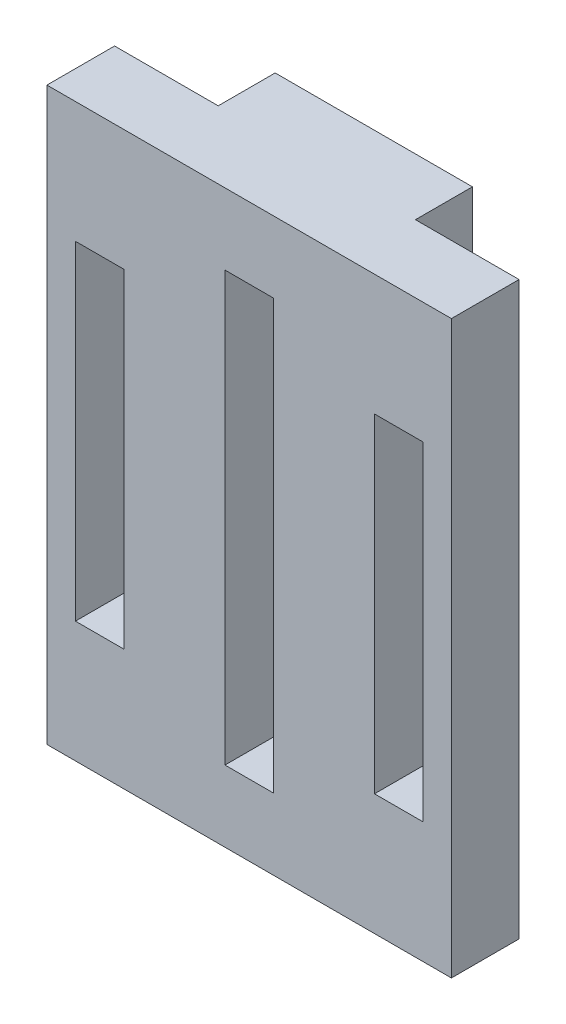
from build123d import *

# Parameters (mm, degrees)
SKETCH1_W           = 28.4
SKETCH1_H           = 40.1
BOSS_EXTRUDE1_DEPTH = 4.75
SKETCH2_W           = 3.4
SKETCH2_H           = 23.1
SKETCH2_H_2         = 30.1
CUT_EXTRUDE1_DEPTH  = 26.024088395
SKETCH4_W           = 13.85
SKETCH4_H           = 38.1
SKETCH4_W_2         = 7.85
SKETCH4_H_2         = 30.1
BOSS_EXTRUDE2_DEPTH = 4


with BuildPart() as part:
    # Sketch1 → Boss-Extrude1 (new body)
    with BuildSketch(Plane.XY):
        Rectangle(SKETCH1_W, SKETCH1_H)
    extrude(amount=BOSS_EXTRUDE1_DEPTH)

    # Sketch2 → Cut-Extrude1 (cut, through all)
    with BuildSketch(Plane.XY.offset(4.75)):
        with Locations((10.5, 0)):
            Rectangle(SKETCH2_W, SKETCH2_H)
        with Locations((-10.5, 0)):
            Rectangle(SKETCH2_W, SKETCH2_H)
        Rectangle(SKETCH2_W, SKETCH2_H_2)
    extrude(amount=-CUT_EXTRUDE1_DEPTH, mode=Mode.SUBTRACT)

    # Sketch4 → Boss-Extrude2 (add)
    with BuildSketch(Plane(origin=(0, 0, 0), x_dir=(-1, 0, 0), z_dir=(0, 0, -1))):
        with Locations((0, 1)):
            Rectangle(SKETCH4_W, SKETCH4_H)
        Rectangle(SKETCH4_W_2, SKETCH4_H_2, mode=Mode.SUBTRACT)
    extrude(amount=BOSS_EXTRUDE2_DEPTH)


solid = part.part
